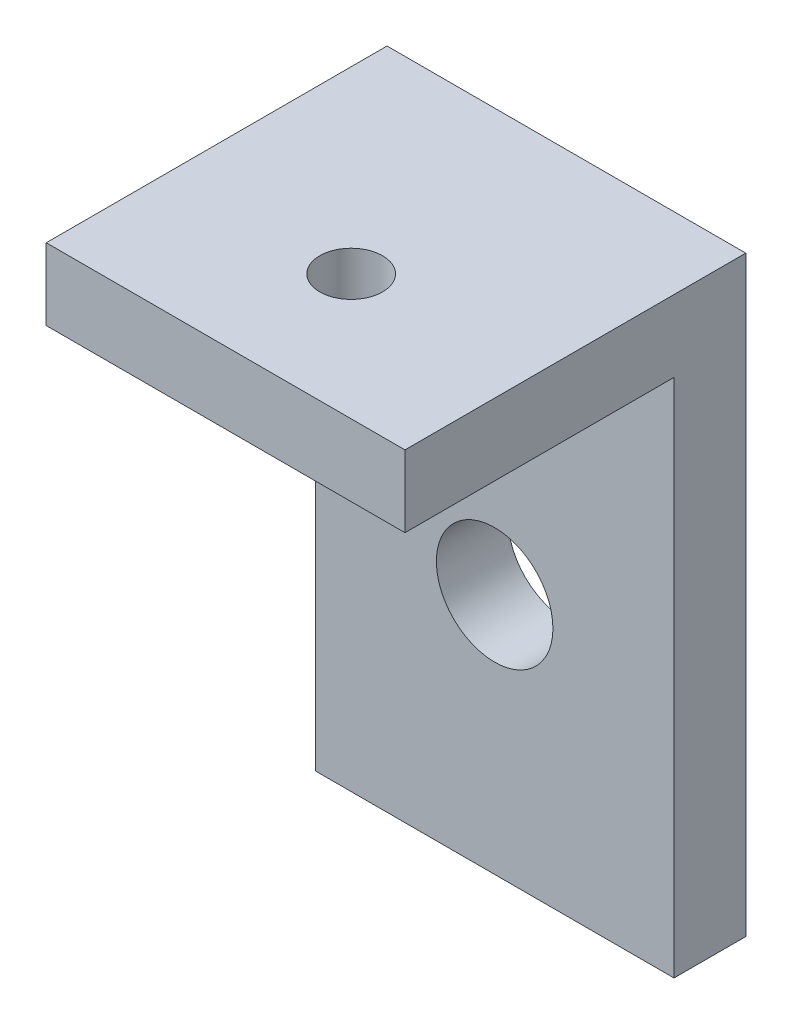
from build123d import *

# Parameters (mm, degrees)
IZIM1_W                     = 20
IZIM1_H                     = 33
IZIM1_R                     = 3.25
Y_KSEKLIK_EKSTR_ZYON1_DEPTH = 4
IZIM2_W                     = 20
IZIM2_H                     = 4
Y_KSEKLIK_EKSTR_ZYON2_DEPTH = 15
IZIM3_R                     = 1.75
KES_EKSTR_ZYON1_DEPTH       = 15


with BuildPart() as part:
    # Çizim1 → Yükseklik-Ekstrüzyon1 (new body)
    with BuildSketch(Plane.XY):
        with Locations((10, 16.5)):
            Rectangle(IZIM1_W, IZIM1_H)
        with Locations((10, 13.5)):
            Circle(IZIM1_R, mode=Mode.SUBTRACT)
    extrude(amount=Y_KSEKLIK_EKSTR_ZYON1_DEPTH)

    # Çizim2 → Yükseklik-Ekstrüzyon2 (add)
    with BuildSketch(Plane.XY.offset(4)):
        with Locations((10, 31)):
            Rectangle(IZIM2_W, IZIM2_H)
    extrude(amount=Y_KSEKLIK_EKSTR_ZYON2_DEPTH)

    # Çizim3 → Kes-Ekstrüzyon1 (cut)
    with BuildSketch(Plane(origin=(0, 33, 0), x_dir=(1, 0, 0), z_dir=(0, 1, 0))):
        with Locations(Location((10, -12, 0), (0, 0, 270))):
            Circle(IZIM3_R)
    extrude(amount=-KES_EKSTR_ZYON1_DEPTH, mode=Mode.SUBTRACT)


solid = part.part
